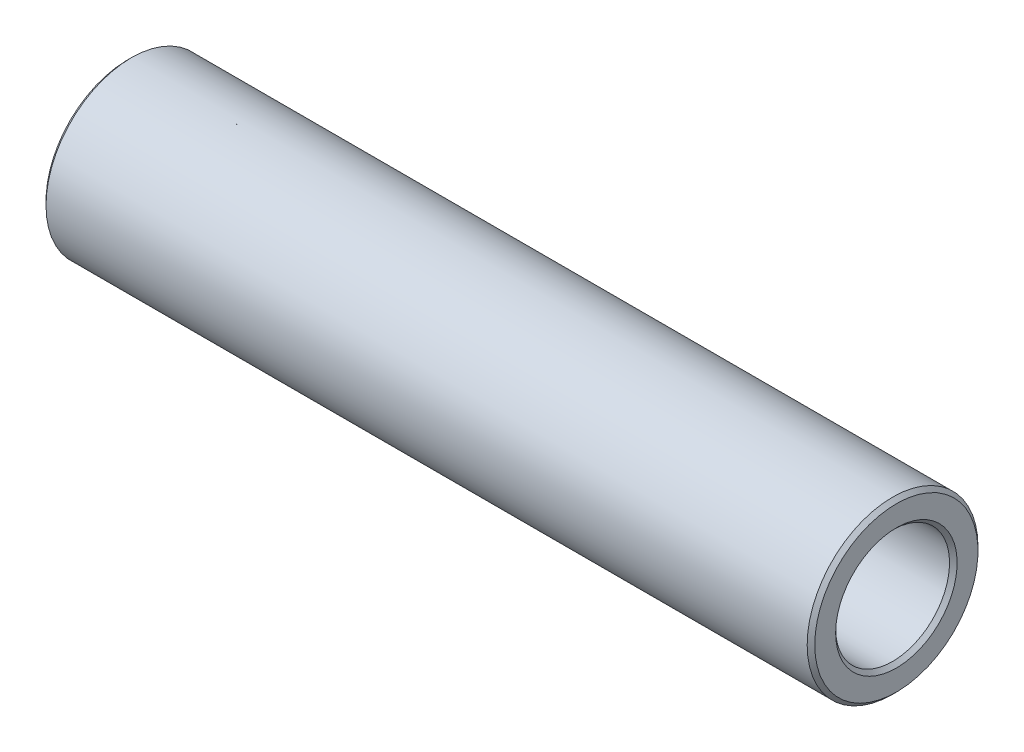
from build123d import *

# Parameters (mm, degrees)
SKETCH1_W     = 40.5
SKETCH1_H     = 1.5
CHAMFER1_SIZE = 0.2


with BuildPart() as part:
    # Sketch1 → Revolve1 (revolve)
    with BuildSketch(Plane.XY):
        with Locations((20.25, 3.75)):
            Rectangle(SKETCH1_W, SKETCH1_H)
    revolve(axis=Axis((0, 0, 0), (1, 0, 0)))

    # Chamfer1
    chamfer1_edges = [part.edges().sort_by_distance(p)[0] for p in [
        (0, -3, 0),
        (0, -4.5, 0),
        (40.5, -3, 0),
        (40.5, -4.5, 0),
    ]]
    chamfer(chamfer1_edges, length=CHAMFER1_SIZE)


solid = part.part
